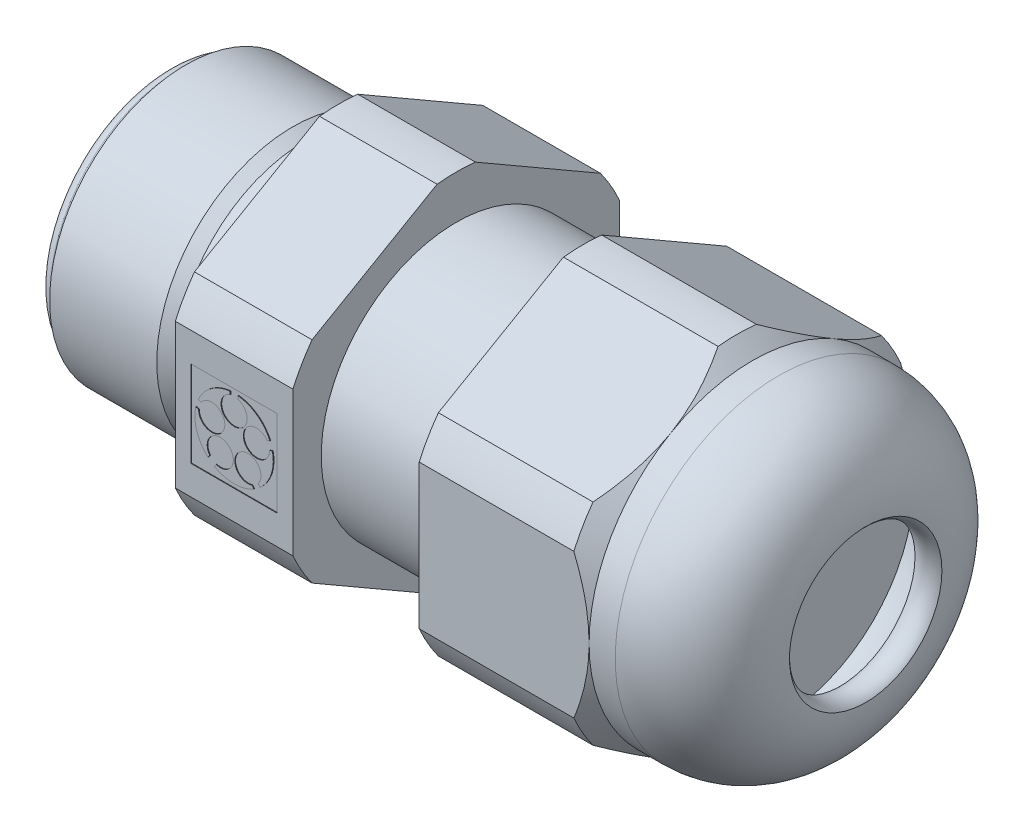
from build123d import *

# Parameters (mm, degrees)
ESQUISSE2_W             = 30
ESQUISSE2_H             = 30
ENL_V_MAT_EXTRU_1_DEPTH = 32
ESQUISSE3_W             = 3.96
ESQUISSE3_H             = 3.96
ENL_V_MAT_EXTRU_2_DEPTH = 0.03


with BuildPart() as part:
    # Esquisse1 → Révolution1 (revolve)
    with BuildSketch(Plane.XY, mode=Mode.PRIVATE) as r_volution1_sk:
        with BuildLine():
            Line((0, 5.4375), (0, 1.75))
            ThreePointArc((0, 1.75), (0.146446609, 1.396446609), (0.5, 1.25))
            Line((0.5, 1.25), (28, 1.25))
            Line((28, 1.25), (28, 6.2))
            ThreePointArc((28, 6.2), (29.872805896, 5.444890248), (30.698075499, 3.601924501))
            ThreePointArc((30.698075499, 3.601924501), (31.322674751, 3.21421659), (32, 3.5))
            ThreePointArc((32, 3.5), (30.828427125, 6.328427125), (28, 7.5))
            Line((28, 7.5), (26.8, 7.5))
            Line((26.8, 7.5), (24.3, 10))
            Line((24.3, 10), (19, 10))
            Line((19, 10), (19, 6.2))
            Line((19, 6.2), (13.2, 6.2))
            Line((13.2, 6.2), (13.2, 10))
            Line((13.2, 10), (7.8, 10))
            Line((7.8, 10), (7.8, 5.9375))
            Line((7.8, 5.9375), (6.24, 5.9375))
            Line((6.24, 5.9375), (5.698734123, 6.25))
            Line((5.698734123, 6.25), (0.78, 6.25))
            Line((0.78, 6.25), (0.78, 5.9375))
            Line((0.78, 5.9375), (0.5, 5.9375))
            ThreePointArc((0.5, 5.9375), (0.146446609, 5.791053391), (0, 5.4375))
        make_face()
    revolve(r_volution1_sk.sketch.rotate(Axis((32, 0, 0), (-1, 0, 0)), 90), axis=Axis((32, 0, 0), (-1, 0, 0)))

    # Esquisse2 → Enlèv. mat.-Extru.1 (cut)
    with BuildSketch(Plane(origin=(7.8, 0, 0), x_dir=(0, 0, -1), z_dir=(1, 0, 0))):
        Rectangle(ESQUISSE2_W, ESQUISSE2_H)
        with BuildLine():
            Line((-7.5, 3.315116891), (-7.5, -3.315116891))
            ThreePointArc((-7.5, -3.315116891), (-7.101408311, -4.1), (-6.620975444, -4.837632083))
            Line((-6.620975444, -4.837632083), (-0.879024556, -8.152748974))
            ThreePointArc((-0.879024556, -8.152748974), (0, -8.2), (0.879024556, -8.152748974))
            Line((0.879024556, -8.152748974), (6.620975444, -4.837632083))
            ThreePointArc((6.620975444, -4.837632083), (7.101408311, -4.1), (7.5, -3.315116891))
            Line((7.5, -3.315116891), (7.5, 3.315116891))
            ThreePointArc((7.5, 3.315116891), (7.101408311, 4.1), (6.620975444, 4.837632083))
            Line((6.620975444, 4.837632083), (0.879024556, 8.152748974))
            ThreePointArc((0.879024556, 8.152748974), (0, 8.2), (-0.879024556, 8.152748974))
            Line((-0.879024556, 8.152748974), (-6.620975444, 4.837632083))
            ThreePointArc((-6.620975444, 4.837632083), (-7.101408311, 4.1), (-7.5, 3.315116891))
        make_face(mode=Mode.SUBTRACT)
    extrude(amount=ENL_V_MAT_EXTRU_1_DEPTH, mode=Mode.SUBTRACT)

    # Esquisse3 → Enlèv. mat.-Extru.2 (cut)
    with BuildSketch(Plane.XY.offset(7.5)):
        with Locations((10.5, 0)):
            Rectangle(ESQUISSE3_W, ESQUISSE3_H)
        with BuildLine():
            Line((9.301666846, -1.343129797), (9.383142032, -1.230988824))
            ThreePointArc((9.383142032, -1.230988824), (10.217863079, -0.388328157), (9.67438815, -1.442591515))
            Line((9.67438815, -1.442591515), (9.592912964, -1.554732488))
            ThreePointArc((9.592912964, -1.554732488), (10.5, -1.8), (11.407087036, -1.554732488))
            Line((11.407087036, -1.554732488), (11.32561185, -1.442591515))
            ThreePointArc((11.32561185, -1.442591515), (10.782136921, -0.388328157), (11.616857968, -1.230988824))
            Line((11.616857968, -1.230988824), (11.698333154, -1.343129797))
            ThreePointArc((11.698333154, -1.343129797), (12.211901729, -0.55623059), (12.258943773, 0.382252276))
            Line((12.258943773, 0.382252276), (12.127114153, 0.339418236))
            ThreePointArc((12.127114153, 0.339418236), (10.956507128, 0.148328157), (12.015868035, 0.681798582))
            Line((12.015868035, 0.681798582), (12.147697655, 0.724632622))
            ThreePointArc((12.147697655, 0.724632622), (11.558013454, 1.45623059), (10.68, 1.790977387))
            Line((10.68, 1.790977387), (10.68, 1.652363521))
            ThreePointArc((10.68, 1.652363521), (10.5, 0.48), (10.32, 1.652363521))
            Line((10.32, 1.652363521), (10.32, 1.790977387))
            ThreePointArc((10.32, 1.790977387), (9.441986546, 1.45623059), (8.852302345, 0.724632622))
            Line((8.852302345, 0.724632622), (8.984131965, 0.681798582))
            ThreePointArc((8.984131965, 0.681798582), (10.043492872, 0.148328157), (8.872885847, 0.339418236))
            Line((8.872885847, 0.339418236), (8.741056227, 0.382252276))
            ThreePointArc((8.741056227, 0.382252276), (8.788098271, -0.55623059), (9.301666846, -1.343129797))
        make_face(mode=Mode.SUBTRACT)
    extrude(amount=-ENL_V_MAT_EXTRU_2_DEPTH, mode=Mode.SUBTRACT)


solid = part.part
